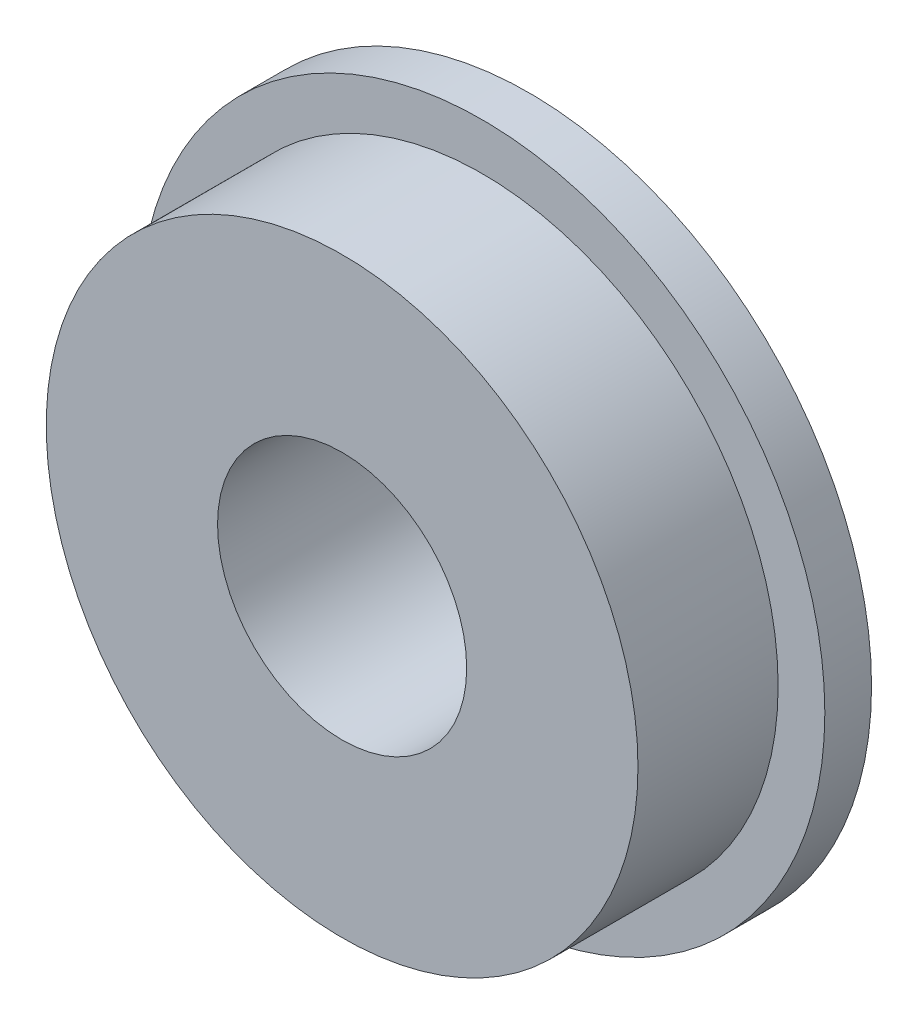
from build123d import *

# Parameters (mm, degrees)
SKETCH_1_R          = 11
EXTRUDE_1_DEPTH     = 1.5
SKETCH_2_R          = 9.5
EXTRUDE_2_DEPTH     = 4.5
SKETCH_3_R          = 4
CUT_EXTRUDE_1_DEPTH = 17.673332001


with BuildPart() as part:
    # 草图1 → 凸台-拉伸1 (new body)
    with BuildSketch(Plane.XY):
        Circle(SKETCH_1_R)
    extrude(amount=EXTRUDE_1_DEPTH)

    # 草图2 → 凸台-拉伸2 (add)
    with BuildSketch(Plane.XY.offset(1.5)):
        Circle(SKETCH_2_R)
    extrude(amount=EXTRUDE_2_DEPTH)

    # 草图3 → 切除-拉伸1 (cut, through all)
    with BuildSketch(Plane.XY.offset(6)):
        Circle(SKETCH_3_R)
    extrude(amount=-CUT_EXTRUDE_1_DEPTH, mode=Mode.SUBTRACT)


solid = part.part
